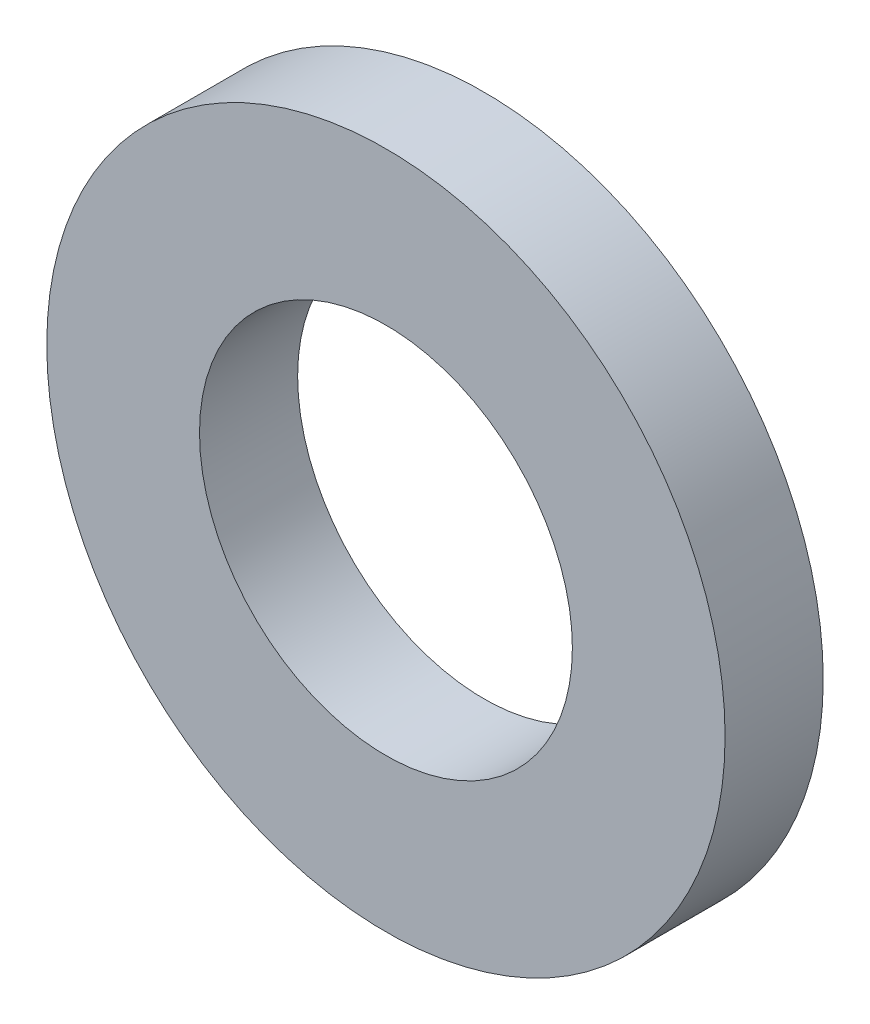
from build123d import *

# Parameters (mm, degrees)
SKETCH1_R           = 3.456482157
SKETCH1_R_2         = 1.9
BOSS_EXTRUDE1_DEPTH = 1


with BuildPart() as part:
    # Sketch1 → Boss-Extrude1 (new body)
    with BuildSketch(Plane.XY):
        Circle(SKETCH1_R)
        Circle(SKETCH1_R_2, mode=Mode.SUBTRACT)
    extrude(amount=BOSS_EXTRUDE1_DEPTH)


solid = part.part
